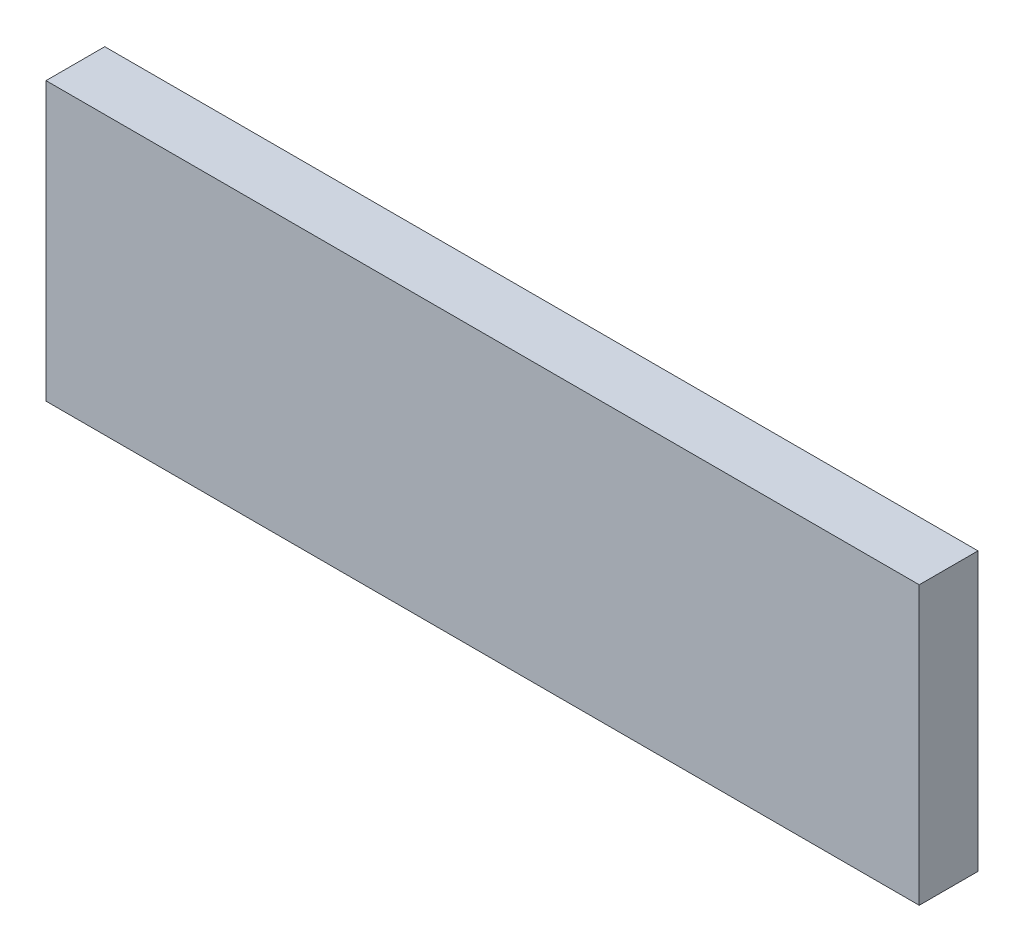
from build123d import *

# Parameters (mm, degrees)
SKETCH1_W           = 283.1
SKETCH1_H           = 90
BOSS_EXTRUDE1_DEPTH = 19.05


with BuildPart() as part:
    # Sketch1 → Boss-Extrude1 (new body)
    with BuildSketch(Plane.XY):
        with Locations((0, 45)):
            Rectangle(SKETCH1_W, SKETCH1_H)
    extrude(amount=BOSS_EXTRUDE1_DEPTH)


solid = part.part
